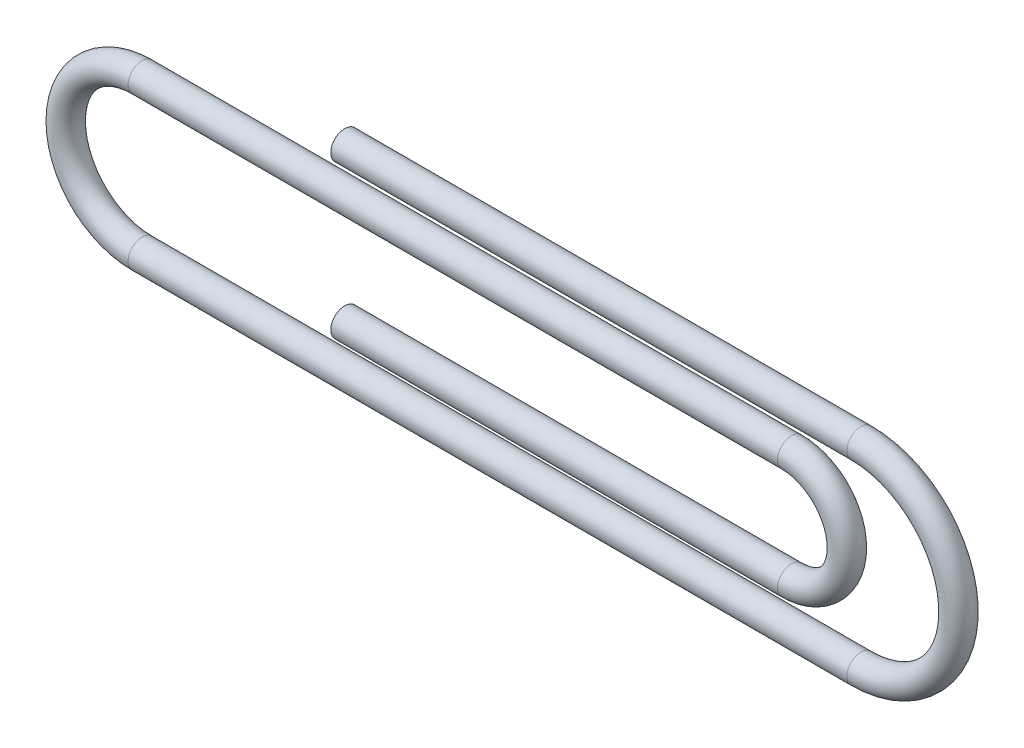
from build123d import *

# Parameters (mm, degrees)
SKETCH2_R = 0.5


with BuildPart() as part:
    # Sweep1: sweep along a path in Sketch1
    with BuildLine(Plane.XY) as sweep1_path:
        Line((0, 0), (18.5, 0))
        ThreePointArc((18.5, 0), (22, -3.5), (18.5, -7))
        Line((18.5, -7), (-7.263950986, -7))
        ThreePointArc((-7.263950986, -7), (-10, -4.263950986), (-7.263950986, -1.527901973))
        Line((-7.263950986, -1.527901973), (16.013950986, -1.527901973))
        ThreePointArc((16.013950986, -1.527901973), (18, -3.513950986), (16.013950986, -5.5))
        Line((16.013950986, -5.5), (0, -5.5))
    # Sketch2 → Sweep1 (sweep)
    with BuildSketch(Plane(origin=(0, 0, 0), x_dir=(0, 0, -1), z_dir=(1, 0, 0))):
        Circle(SKETCH2_R)
    sweep(path=sweep1_path.line)


solid = part.part
